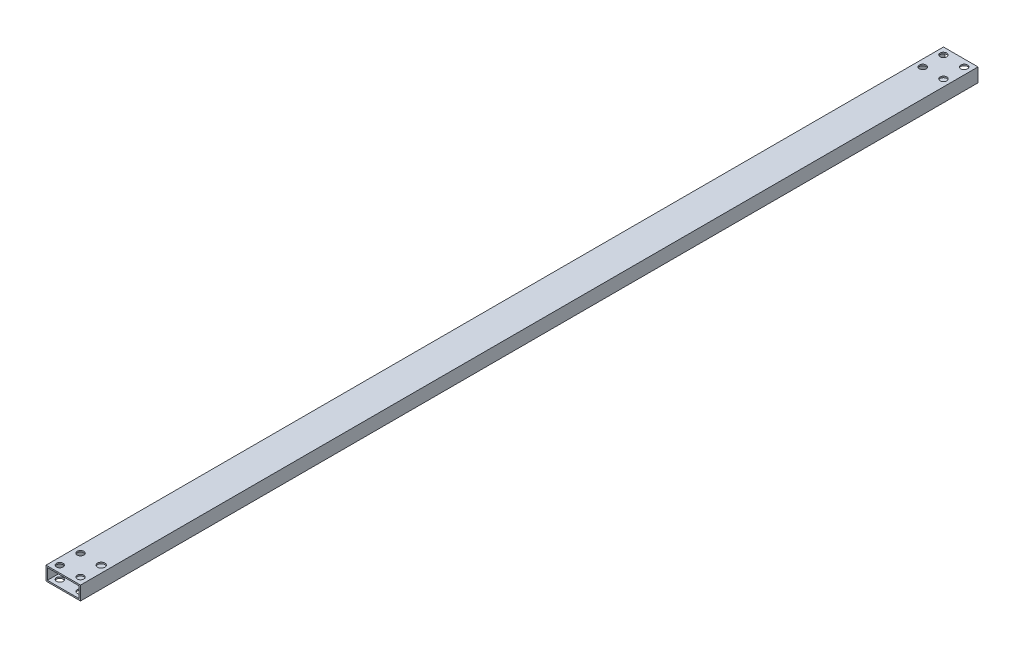
from build123d import *

# Parameters (mm, degrees)
SKETCH_1_W          = 50
SKETCH_1_H          = 20
EXTRUDE_1_DEPTH     = 1300
SKETCH_2_W          = 46
SKETCH_2_H          = 16
CUT_EXTRUDE_1_DEPTH = 1301.278816254
SKETCH_3_R          = 4.80233269
SKETCH_3_R_2        = 4.787191165
SKETCH_3_R_3        = 5.290306375
SKETCH_3_R_4        = 4.870795403
CUT_EXTRUDE_2_DEPTH = 1301.394171011


with BuildPart() as part:
    # Эскиз1 → Бобышка-Вытянуть1 (new body)
    with BuildSketch(Plane.XY):
        Rectangle(SKETCH_1_W, SKETCH_1_H)
    extrude(amount=EXTRUDE_1_DEPTH)

    # Эскиз2 → Вырез-Вытянуть1 (cut, through all)
    with BuildSketch(Plane.XY.offset(1300)):
        Rectangle(SKETCH_2_W, SKETCH_2_H)
    extrude(amount=-CUT_EXTRUDE_1_DEPTH, mode=Mode.SUBTRACT)

    # Эскиз3 → Вырез-Вытянуть2 (cut, through all)
    with BuildSketch(Plane(origin=(0, 10, 0), x_dir=(1, 0, 0), z_dir=(0, 1, 0))):
        with Locations((15, -1290)):
            Circle(SKETCH_3_R)
        with Locations((-15, -1290)):
            Circle(SKETCH_3_R_2)
        with Locations((15, -1260)):
            Circle(SKETCH_3_R_3)
        with Locations((-15, -1260)):
            Circle(SKETCH_3_R_4)
        with Locations((15, -10)):
            Circle(SKETCH_3_R_4)
        with Locations((-15, -10)):
            Circle(SKETCH_3_R_4)
        with Locations((15, -40)):
            Circle(SKETCH_3_R_4)
        with Locations((-15, -40)):
            Circle(SKETCH_3_R_4)
    extrude(amount=-CUT_EXTRUDE_2_DEPTH, mode=Mode.SUBTRACT)


solid = part.part
